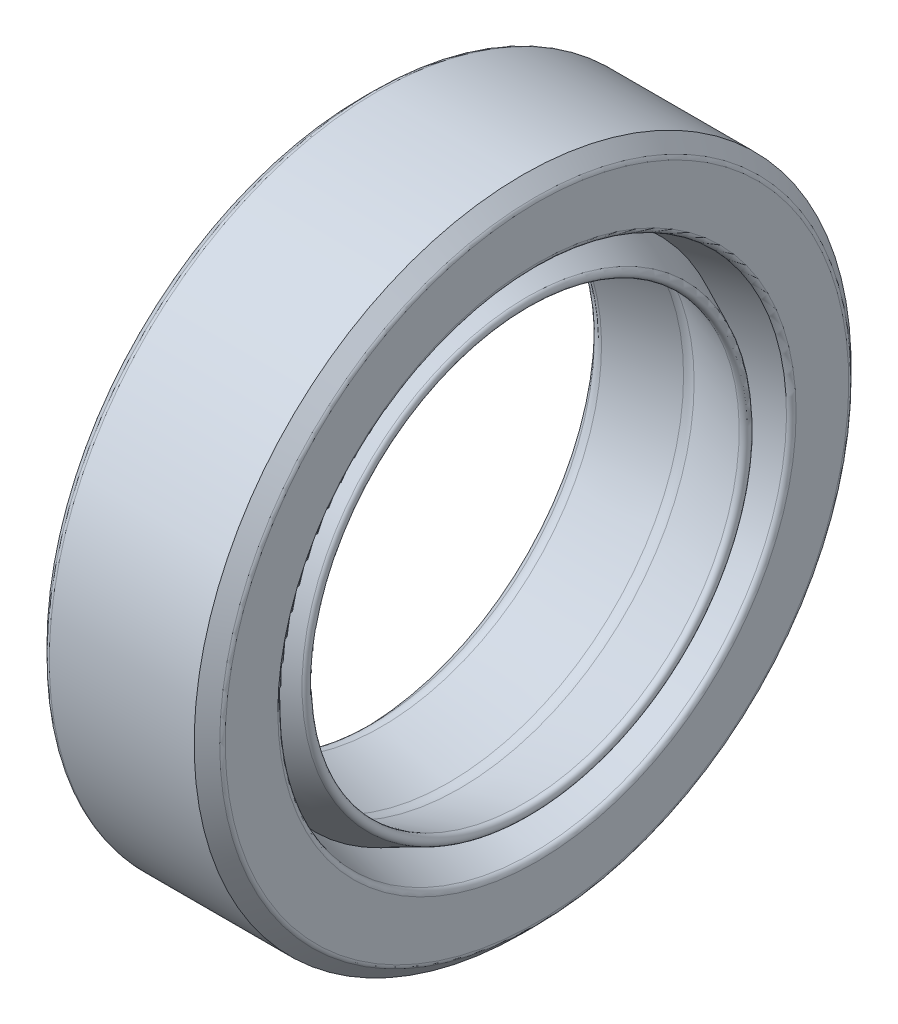
from build123d import *


with BuildPart() as part:
    # Sketch1 → Revolve1 (revolve)
    with BuildSketch(Plane.XY):
        with BuildLine():
            Line((-6.849938876, 12.332324863), (-7.185287643, 12.66767363))
            ThreePointArc((-7.185287643, 12.66767363), (-7.239480831, 12.748779467), (-7.258510948, 12.844450325))
            Line((-7.258510948, 12.844450325), (-7.258510948, 14.274009547))
            ThreePointArc((-7.258510948, 14.274009547), (-7.239480831, 14.369680405), (-7.185287643, 14.450786242))
            Line((-7.185287643, 14.450786242), (-6.70929719, 14.926776695))
            ThreePointArc((-6.70929719, 14.926776695), (-6.628191352, 14.980969883), (-6.532520494, 15))
            Line((-6.532520494, 15), (0.083888479, 15))
            Line((0.083888479, 15), (0.668265748, 14.415622731))
            ThreePointArc((0.668265748, 14.415622731), (0.722458936, 14.334516894), (0.741489052, 14.238846036))
            Line((0.741489052, 14.238846036), (0.741489052, 11.835710097))
            ThreePointArc((0.741489052, 11.835710097), (0.686454956, 11.679222728), (0.54558268, 11.591632487))
            Line((0.54558268, 11.591632487), (-1.560032713, 11.124976106))
            Line((-1.560032713, 11.124976106), (0.282360124, 10.271430845))
            ThreePointArc((0.282360124, 10.271430845), (0.397866803, 9.988725545), (0.124290827, 9.853004267))
            Line((0.124290827, 9.853004267), (-2.800876749, 10.721300524))
            ThreePointArc((-2.800876749, 10.721300524), (-3.050222113, 10.762023188), (-3.301815552, 10.738954005))
            Line((-3.301815552, 10.738954005), (-6.368283936, 10.059348867))
            ThreePointArc((-6.368283936, 10.059348867), (-6.616401703, 10.067483825), (-6.830024581, 10.193950696))
            Line((-6.830024581, 10.193950696), (-7.258510948, 10.622437063))
            Line((-7.258510948, 10.622437063), (-7.258510948, 11.028000426))
            Line((-7.258510948, 11.028000426), (-2.018932217, 12.391016438))
            ThreePointArc((-2.018932217, 12.391016438), (-1.884090665, 12.480050465), (-1.831872061, 12.632963903))
            Line((-1.831872061, 12.632963903), (-1.831872061, 13.05467024))
            ThreePointArc((-1.831872061, 13.05467024), (-1.92621723, 13.250301458), (-2.13804465, 13.298277794))
            Line((-2.13804465, 13.298277794), (-6.616989592, 12.265494005))
            ThreePointArc((-6.616989592, 12.265494005), (-6.742103667, 12.268795355), (-6.849938876, 12.332324863))
        make_face()
    revolve(axis=Axis((0, 0, 0), (-1, 0, 0)))


solid = part.part
